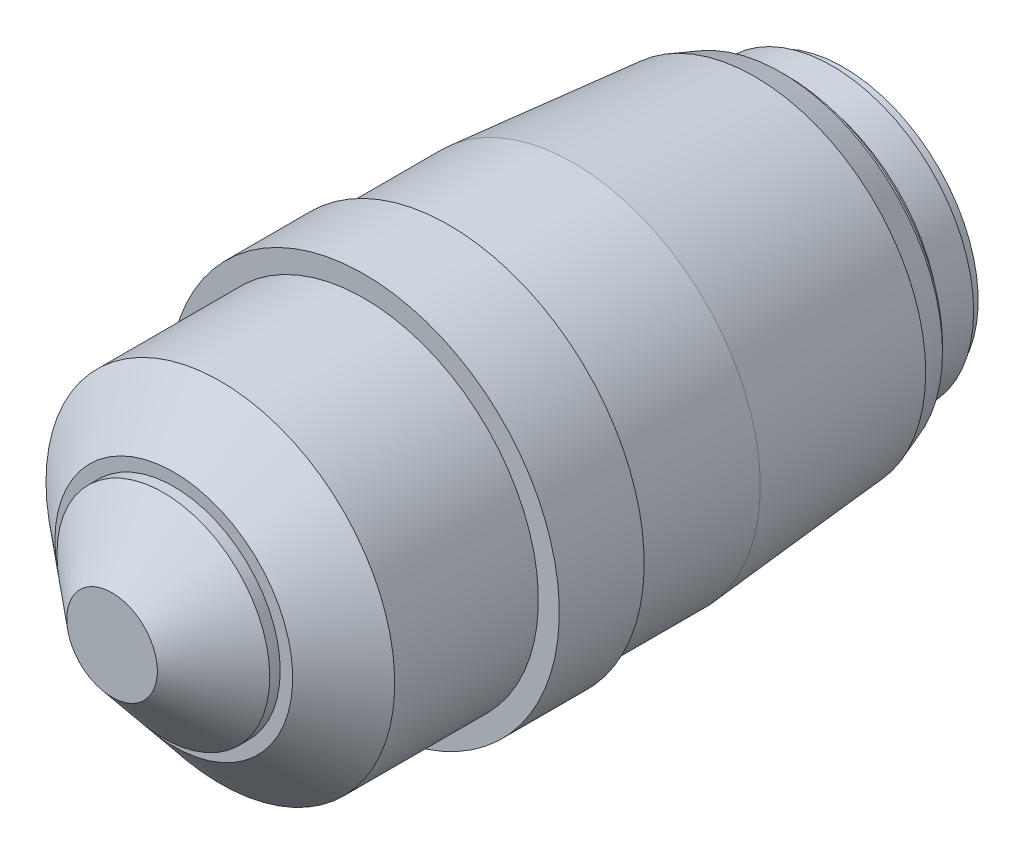
from build123d import *

# Parameters (mm, degrees)
SKETCH2_R          = 4.75
CUT_EXTRUDE1_DEPTH = 1


with BuildPart() as part:
    # Sketch1 → Revolve1 (revolve)
    with BuildSketch(Plane(origin=(0, 0, 0), x_dir=(1, 0, 0), z_dir=(0, 1, 0)), mode=Mode.PRIVATE) as revolve1_sk:
        Polygon((0, 0.38), (4, 0.38), (9.4, 4.911138008), (9.4, 5.834147603), (10.5, 5.834147603), (15.4, 9.945735795), (15.4, 22.634147603), (17.25, 22.634147603), (17.25, 30.134147603), (16.5, 30.134147603), (16.5, 41.134147603), (15.099029854, 57.147309648), (14.25, 59.48), (13.75, 59.48), (13.75, 59.98), (11.9, 59.98), (11.9, 60.98), (12.5, 60.98), (12.5, 63.98), (11.9, 63.98), (11.9, 64.98), (0, 64.98), align=None)
    revolve(revolve1_sk.sketch.rotate(Axis((0, 0, -64.98), (0, 0, 1)), 180), axis=Axis((0, 0, -64.98), (0, 0, 1)))

    # Sketch2 → Cut-Extrude1 (cut)
    with BuildSketch(Plane(origin=(0, 0, -64.98), x_dir=(-1, 0, 0), z_dir=(0, 0, -1))):
        Circle(SKETCH2_R)
    extrude(amount=-CUT_EXTRUDE1_DEPTH, mode=Mode.SUBTRACT)


solid = part.part
